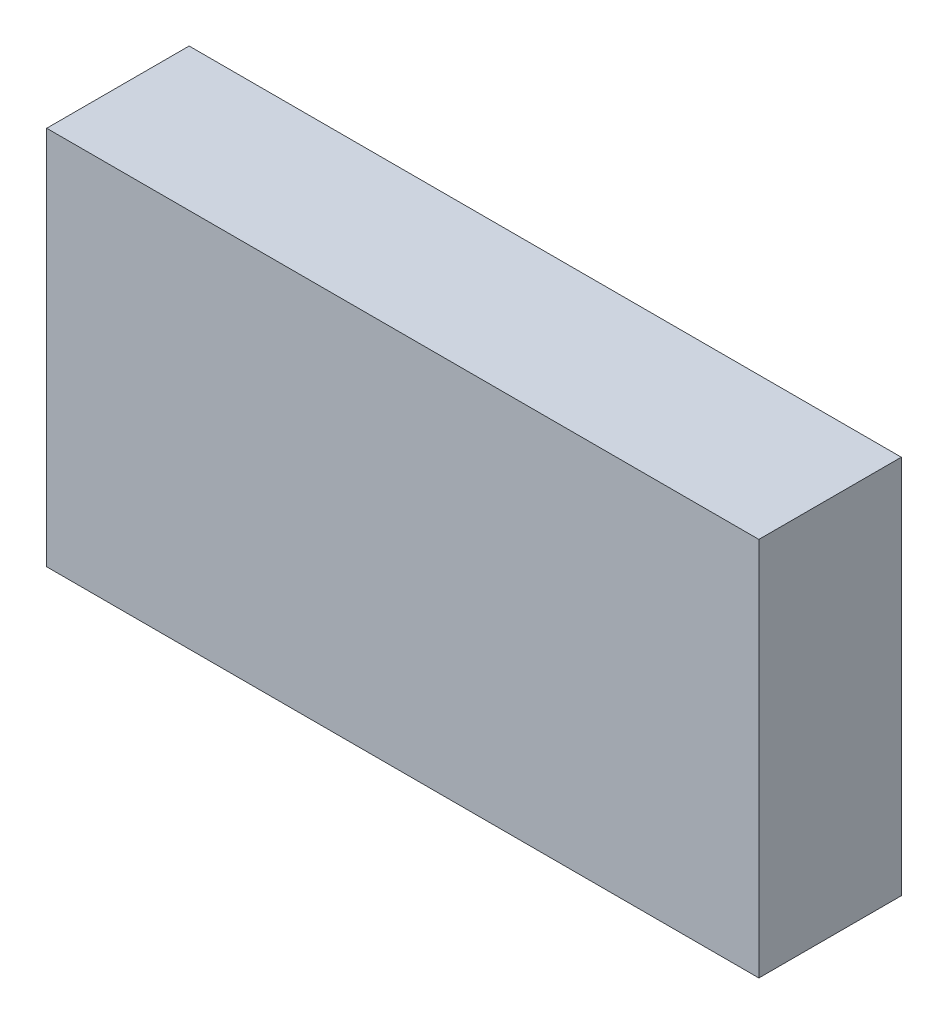
from build123d import *

# Parameters (mm, degrees)
SKETCH1_W                          = 15
SKETCH1_H                          = 8
CEK_ICECEK_MIKNATIS_15X8X3_1_DEPTH = 3


with BuildPart() as part:
    # Sketch1 → CEK_icecek_miknatis_15x8x3_1 (new body)
    with BuildSketch(Plane.XY):
        with Locations((603.5, 102)):
            Rectangle(SKETCH1_W, SKETCH1_H)
    extrude(amount=-CEK_ICECEK_MIKNATIS_15X8X3_1_DEPTH)


solid = part.part
